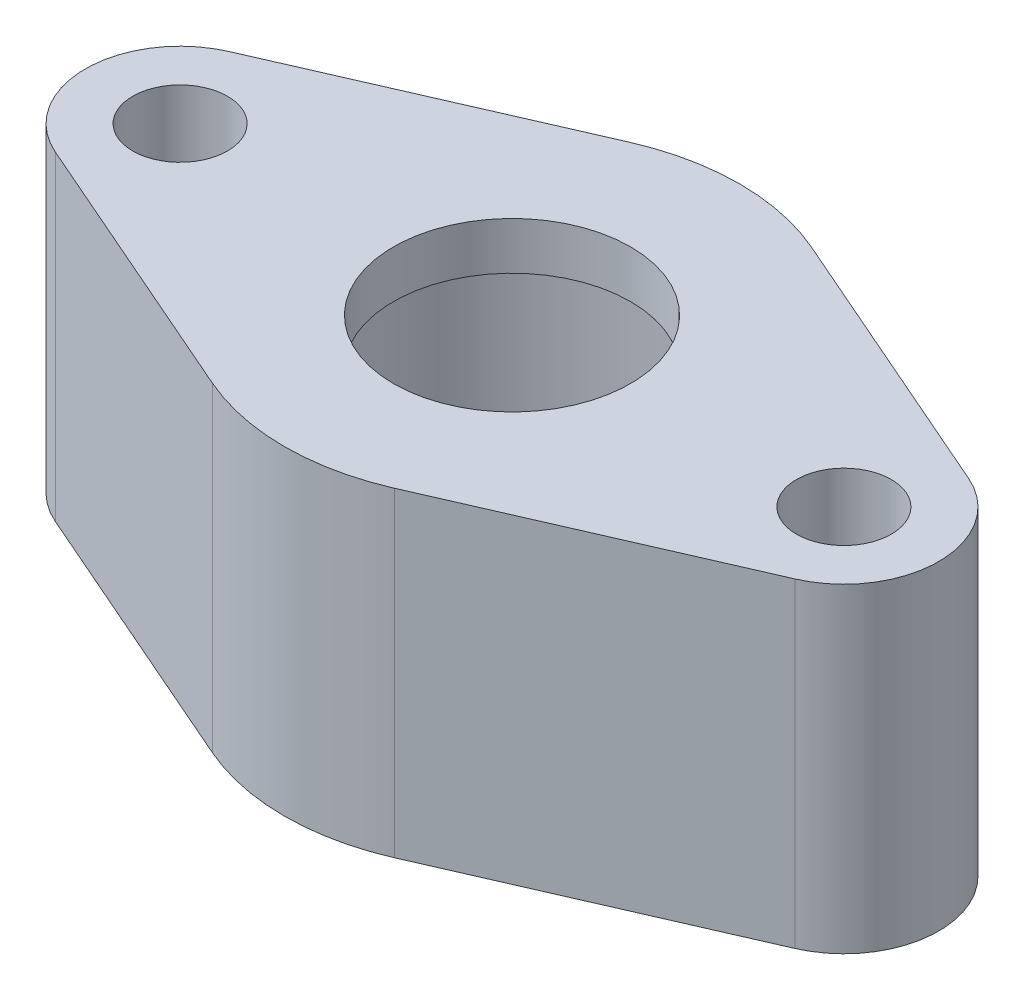
from build123d import *

# Parameters (mm, degrees)
SKETCH1_R           = 2
SKETCH1_R_2         = 9.6
SKETCH1_R_3         = 7.6
BOSS_EXTRUDE1_DEPTH = 11.5
SKETCH2_R           = 5
SKETCH2_R_2         = 2
BOSS_EXTRUDE2_DEPTH = 2


with BuildPart() as part:
    # Sketch1 → Boss-Extrude1 (new body)
    # profile 1 of 3: a face of its own
    with BuildSketch(Plane(origin=(0, 0, 0), x_dir=(1, 0, 0), z_dir=(0, 1, 0))):
        with BuildLine():
            ThreePointArc((-3.84, -8.798545334), (-9.6, 0), (-3.84, 8.798545334))
            Line((-3.84, 8.798545334), (-15.6, 3.666060556))
            ThreePointArc((-15.6, 3.666060556), (-18, 0), (-15.6, -3.666060556))
            Line((-15.6, -3.666060556), (-3.84, -8.798545334))
        make_face()
        with Locations(Location((-14, 0, 0), (0, 0, 270))):
            Circle(SKETCH1_R, mode=Mode.SUBTRACT)
    # profile 2 of 3: a face of its own
    with BuildSketch(Plane(origin=(0, 0, 0), x_dir=(1, 0, 0), z_dir=(0, 1, 0))):
        Circle(SKETCH1_R_2)
        with Locations(Location((0, 0, 0), (0, 0, 270))):
            Circle(SKETCH1_R_3, mode=Mode.SUBTRACT)
    # profile 3 of 3: a face of its own
    with BuildSketch(Plane(origin=(0, 0, 0), x_dir=(1, 0, 0), z_dir=(0, 1, 0))):
        with BuildLine():
            Line((15.6, 3.666060556), (3.84, 8.798545334))
            ThreePointArc((3.84, 8.798545334), (8.031936255, 5.258136552), (9.6, 0))
            ThreePointArc((9.6, 0), (8.031936255, -5.258136552), (3.84, -8.798545334))
            Line((3.84, -8.798545334), (15.6, -3.666060556))
            ThreePointArc((15.6, -3.666060556), (18, 0), (15.6, 3.666060556))
        make_face()
        with Locations(Location((14, 0, 0), (0, 0, 270))):
            Circle(SKETCH1_R, mode=Mode.SUBTRACT)
    extrude(amount=BOSS_EXTRUDE1_DEPTH)

    # Sketch2 → Boss-Extrude2 (add)
    with BuildSketch(Plane(origin=(0, 11.5, 0), x_dir=(1, 0, 0), z_dir=(0, 1, 0))):
        with BuildLine():
            Line((-3.84, 8.798545334), (-15.6, 3.666060556))
            ThreePointArc((-15.6, 3.666060556), (-18, 0), (-15.6, -3.666060556))
            Line((-15.6, -3.666060556), (-3.84, -8.798545334))
            ThreePointArc((-3.84, -8.798545334), (0, -9.6), (3.84, -8.798545334))
            Line((3.84, -8.798545334), (15.6, -3.666060556))
            ThreePointArc((15.6, -3.666060556), (18, 0), (15.6, 3.666060556))
            Line((15.6, 3.666060556), (3.84, 8.798545334))
            ThreePointArc((3.84, 8.798545334), (0, 9.6), (-3.84, 8.798545334))
        make_face()
        with Locations(Location((0, 0, 0), (0, 0, 270))):
            Circle(SKETCH2_R, mode=Mode.SUBTRACT)
        with Locations(Location((-14, 0, 0), (0, 0, 270))):
            Circle(SKETCH2_R_2, mode=Mode.SUBTRACT)
        with Locations(Location((14, 0, 0), (0, 0, 270))):
            Circle(SKETCH2_R_2, mode=Mode.SUBTRACT)
    extrude(amount=BOSS_EXTRUDE2_DEPTH)


solid = part.part
